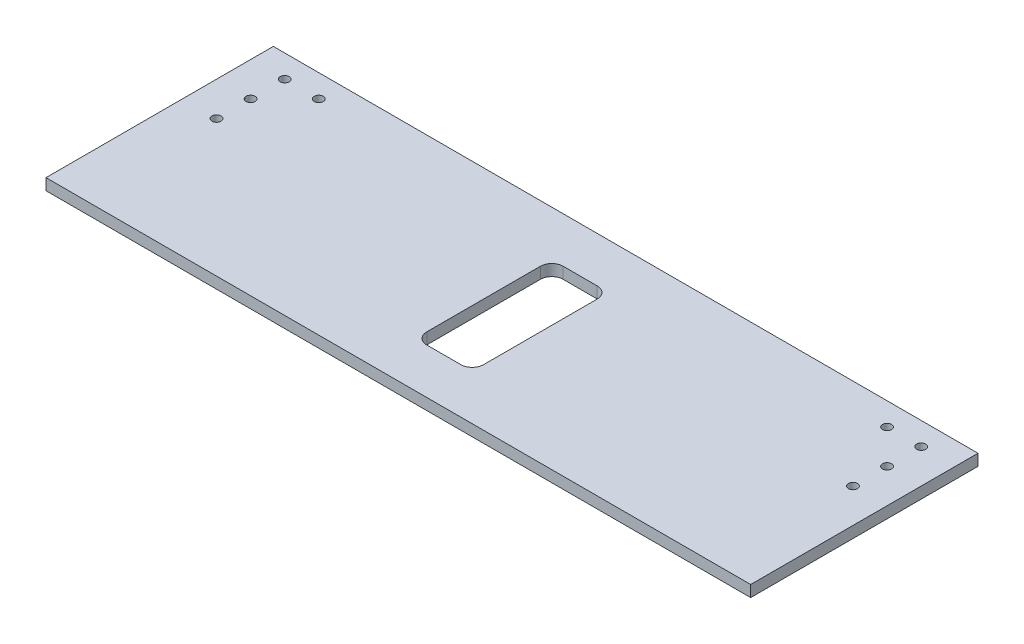
from build123d import *

# Parameters (mm, degrees)
SKETCH1_W           = 120
SKETCH1_H           = 95
SKETCH1_W_2         = 310
SKETCH1_H_2         = 100
BOSS_EXTRUDE1_DEPTH = 5
SKETCH2_R           = 2
SKETCH2_W           = 25
SKETCH2_H           = 60
CUT_EXTRUDE1_DEPTH  = 213.308737456
FILLET1_R           = 5
SKETCH5_W           = 80
SKETCH5_H           = 70
CUT_EXTRUDE2_DEPTH  = 5
CHAMFER1_SIZE       = 20
SKETCH6_W           = 95
SKETCH6_H           = 95
BOSS_EXTRUDE2_DEPTH = 5
SKETCH7_W           = 310
SKETCH7_H           = 95
CUT_EXTRUDE3_DEPTH  = 213.308737456


with BuildPart() as part:
    # Sketch1 → Boss-Extrude1 (new body)
    with BuildSketch(Plane(origin=(0, 0, 0), x_dir=(1, 0, 0), z_dir=(0, 1, 0))):
        with Locations((0, 97.5)):
            Rectangle(SKETCH1_W, SKETCH1_H)
        Rectangle(SKETCH1_W_2, SKETCH1_H_2)
    extrude(amount=BOSS_EXTRUDE1_DEPTH)

    # Sketch2 → Cut-Extrude1 (cut, through all)
    with BuildSketch(Plane(origin=(0, 5, 0), x_dir=(1, 0, 0), z_dir=(0, 1, 0))):
        with Locations(Location((-140, 40, 0), (0, 0, 270))):
            Circle(SKETCH2_R)
        with Locations(Location((-125, 40, 0), (0, 0, 270))):
            Circle(SKETCH2_R)
        with Locations(Location((-140, 25, 0), (0, 0, 270))):
            Circle(SKETCH2_R)
        with Locations(Location((-140, 10, 0), (0, 0, 270))):
            Circle(SKETCH2_R)
        with Locations(Location((140, 10, 0), (0, 0, 90))):
            Circle(SKETCH2_R)
        with Locations(Location((140, 25, 0), (0, 0, 90))):
            Circle(SKETCH2_R)
        with Locations(Location((125, 40, 0), (0, 0, 90))):
            Circle(SKETCH2_R)
        with Locations(Location((140, 40, 0), (0, 0, 90))):
            Circle(SKETCH2_R)
        with Locations(Location((-50, 130, 0), (0, 0, 270))):
            Circle(SKETCH2_R)
        with Locations(Location((50, 130, 0), (0, 0, 90))):
            Circle(SKETCH2_R)
        Rectangle(SKETCH2_W, SKETCH2_H)
    extrude(amount=-CUT_EXTRUDE1_DEPTH, mode=Mode.SUBTRACT)

    # Fillet1
    fillet1_edges = [part.edges().sort_by_distance(p)[0] for p in [
        (12.5, 2.5, -30),
        (12.5, 2.5, 30),
        (-12.5, 2.5, 30),
        (-12.5, 2.5, -30),
    ]]
    fillet(fillet1_edges, radius=FILLET1_R)

    # Sketch5 → Cut-Extrude2 (cut)
    with BuildSketch(Plane(origin=(0, 5, 0), x_dir=(1, 0, 0), z_dir=(0, 1, 0))):
        with Locations((0, 85)):
            Rectangle(SKETCH5_W, SKETCH5_H)
    extrude(amount=-CUT_EXTRUDE2_DEPTH, mode=Mode.SUBTRACT)

    # Chamfer1
    chamfer1_edges = [part.edges().sort_by_distance(p)[0] for p in [
        (40, 2.5, -50),
        (-40, 2.5, -50),
        (-40, 2.5, -120),
        (40, 2.5, -120),
    ]]
    chamfer(chamfer1_edges, length=CHAMFER1_SIZE)

    # Sketch6 → Boss-Extrude2 (add)
    with BuildSketch(Plane(origin=(0, 5, 0), x_dir=(1, 0, 0), z_dir=(0, 1, 0))):
        with Locations((107.5, 97.5)):
            Rectangle(SKETCH6_W, SKETCH6_H)
        with Locations((-107.5, 97.5)):
            Rectangle(SKETCH6_W, SKETCH6_H)
    extrude(amount=-BOSS_EXTRUDE2_DEPTH)

    # Sketch7 → Cut-Extrude3 (cut, through all)
    with BuildSketch(Plane(origin=(0, 5, 0), x_dir=(1, 0, 0), z_dir=(0, 1, 0))):
        with Locations((0, 97.5)):
            Rectangle(SKETCH7_W, SKETCH7_H)
    extrude(amount=-CUT_EXTRUDE3_DEPTH, mode=Mode.SUBTRACT)


solid = part.part
